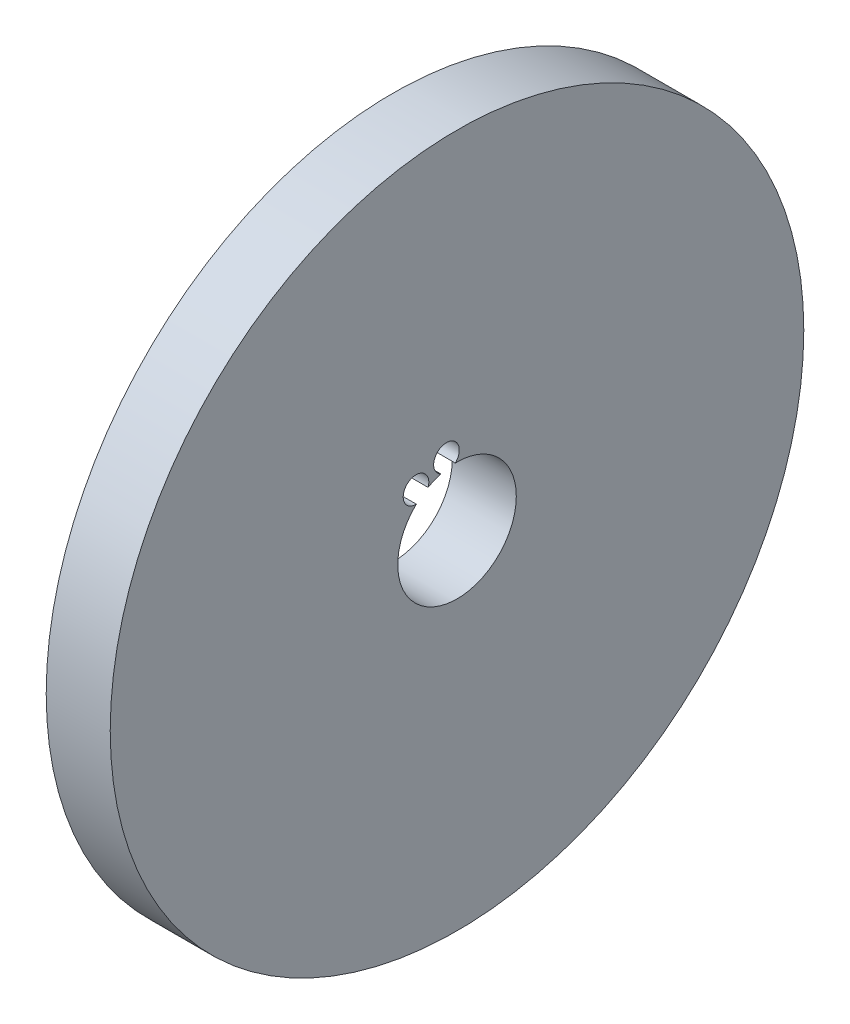
from build123d import *

# Parameters (mm, degrees)
AXIAL_PROFILE_MM_W     = 12
AXIAL_PROFILE_MM_H     = 53.8875
AXIAL_HOLES_DEPTH      = 96.448886845
AXIAL_HOLES_DEPTH_BACK = 96.448886845
SKETCH2_R              = 2.4


with BuildPart() as part:
    # Axial profile (mm) → Full revolution (revolve)
    with BuildSketch(Plane.XY, mode=Mode.PRIVATE) as full_revolution_sk:
        with Locations((19.7, 38.05625)):
            Rectangle(AXIAL_PROFILE_MM_W, AXIAL_PROFILE_MM_H)
    revolve(full_revolution_sk.sketch.rotate(Axis((-110, 0, 0), (1, 0, 0)), 90), axis=Axis((-110, 0, 0), (1, 0, 0)))

    # Sketch2 → Axial holes (cut, two sides: drawn at the far end of the back side and taken through both)
    with BuildSketch(Plane(origin=(0, 0, 0), x_dir=(0, 0, -1), z_dir=(1, 0, 0)).offset(-AXIAL_HOLES_DEPTH_BACK)):
        with Locations((-1.977382665, 12.848733704)):
            Circle(SKETCH2_R)
        with Locations((-7.687206041, 10.483647423)):
            Circle(SKETCH2_R)
    extrude(amount=AXIAL_HOLES_DEPTH + AXIAL_HOLES_DEPTH_BACK, mode=Mode.SUBTRACT)


solid = part.part
